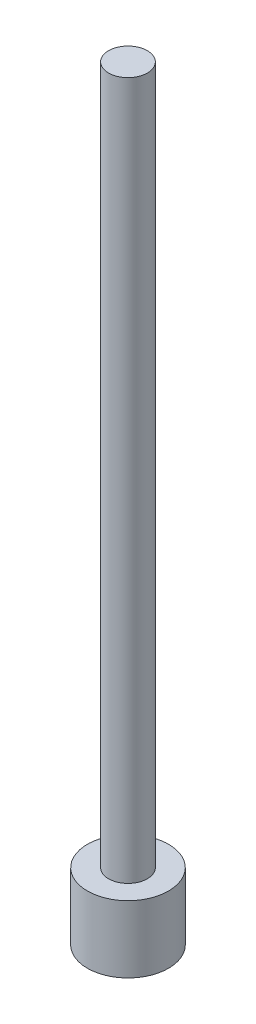
from build123d import *

# Parameters (mm, degrees)
SKETCH2_R           = 2.875
BOSS_EXTRUDE1_DEPTH = 4.75
SKETCH3_R           = 1.375
BOSS_EXTRUDE2_DEPTH = 49.5


with BuildPart() as part:
    # Sketch2 → Boss-Extrude1 (new body)
    with BuildSketch(Plane(origin=(0, 0, 0), x_dir=(1, 0, 0), z_dir=(0, 1, 0))):
        with Locations(Location((0, 0, 0), (0, 0, 270))):
            Circle(SKETCH2_R)
    extrude(amount=BOSS_EXTRUDE1_DEPTH)

    # Sketch3 → Boss-Extrude2 (add)
    with BuildSketch(Plane(origin=(0, 4.75, 0), x_dir=(1, 0, 0), z_dir=(0, 1, 0))):
        with Locations(Location((0, 0, 0), (0, 0, 270))):
            Circle(SKETCH3_R)
    extrude(amount=BOSS_EXTRUDE2_DEPTH)


solid = part.part
